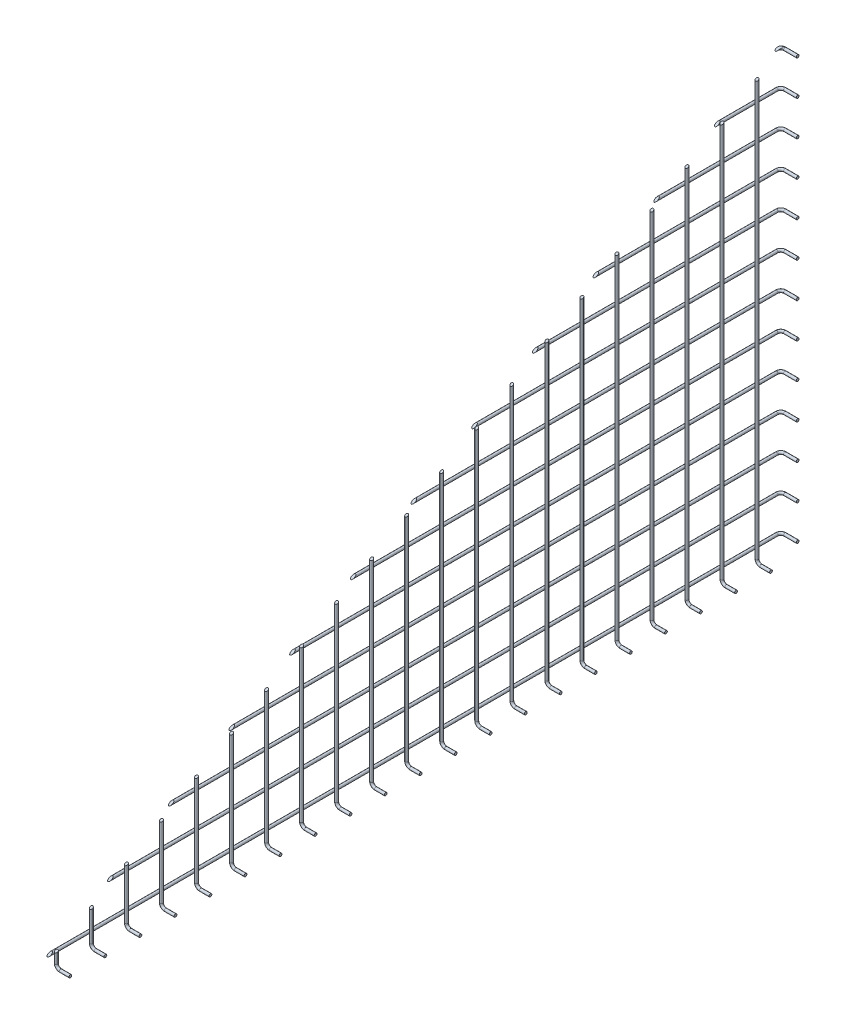
from build123d import *

# Parameters (mm, degrees)
SKETCH_2_R               = 2
PATTERN_LINEAR_2_COUNT   = 11
PATTERN_LINEAR_2_PITCH   = 50
PATTERN_LINEAR_3_COUNT   = 11
PATTERN_LINEAR_3_PITCH   = 50
SKETCH_4_R               = 2
PATTERN_LINEAR_4_COUNT   = 18
PATTERN_LINEAR_4_PITCH   = 50
CUT_EXTRUDE_1_DEPTH      = 1042.201229402
CUT_EXTRUDE_1_DEPTH_BACK = 1042.201229402
SKETCH_5_OUTSIDE_W       = 1361.942
SKETCH_5_OUTSIDE_H       = 1171.942


with BuildPart() as part:
    # По траектории1: sweep along a path in Эскиз1
    with BuildLine(Plane.XY) as sweep_1_path:
        Line((20, 2), (6, 2))
        ThreePointArc((6, 2), (1.757359313, 3.757359313), (0, 8))
        Line((0, 8), (0, 890))
    # Эскиз2 → По траектории1 (sweep)
    with BuildSketch(Plane(origin=(20, 0, 0), x_dir=(0, 0, -1), z_dir=(1, 0, 0))):
        with Locations((0, 2)):
            Circle(SKETCH_2_R)
    sweep(path=sweep_1_path.line)


with BuildPart() as pattern_linear_2_1:
    # Линейный массив2: pattern copy
    add(part.part.moved(Location(Vector(0, 0, -1) * (1 * PATTERN_LINEAR_2_PITCH))))


with BuildPart() as pattern_linear_2_2:
    # Линейный массив2: pattern copy
    add(part.part.moved(Location(Vector(0, 0, -1) * (2 * PATTERN_LINEAR_2_PITCH))))


with BuildPart() as pattern_linear_2_3:
    # Линейный массив2: pattern copy
    add(part.part.moved(Location(Vector(0, 0, -1) * (3 * PATTERN_LINEAR_2_PITCH))))


with BuildPart() as pattern_linear_2_4:
    # Линейный массив2: pattern copy
    add(part.part.moved(Location(Vector(0, 0, -1) * (4 * PATTERN_LINEAR_2_PITCH))))


with BuildPart() as pattern_linear_2_5:
    # Линейный массив2: pattern copy
    add(part.part.moved(Location(Vector(0, 0, -1) * (5 * PATTERN_LINEAR_2_PITCH))))


with BuildPart() as pattern_linear_2_6:
    # Линейный массив2: pattern copy
    add(part.part.moved(Location(Vector(0, 0, -1) * (6 * PATTERN_LINEAR_2_PITCH))))


with BuildPart() as pattern_linear_2_7:
    # Линейный массив2: pattern copy
    add(part.part.moved(Location(Vector(0, 0, -1) * (7 * PATTERN_LINEAR_2_PITCH))))


with BuildPart() as pattern_linear_2_8:
    # Линейный массив2: pattern copy
    add(part.part.moved(Location(Vector(0, 0, -1) * (8 * PATTERN_LINEAR_2_PITCH))))


with BuildPart() as pattern_linear_2_9:
    # Линейный массив2: pattern copy
    add(part.part.moved(Location(Vector(0, 0, -1) * (9 * PATTERN_LINEAR_2_PITCH))))


with BuildPart() as pattern_linear_2_10:
    # Линейный массив2: pattern copy
    add(part.part.moved(Location(Vector(0, 0, -1) * (10 * PATTERN_LINEAR_2_PITCH))))


with BuildPart() as pattern_linear_3_1:
    # Линейный массив3: pattern copy
    add(part.part.moved(Location(Vector(0, 0, 1) * (1 * PATTERN_LINEAR_3_PITCH))))


with BuildPart() as pattern_linear_3_2:
    # Линейный массив3: pattern copy
    add(part.part.moved(Location(Vector(0, 0, 1) * (2 * PATTERN_LINEAR_3_PITCH))))


with BuildPart() as pattern_linear_3_3:
    # Линейный массив3: pattern copy
    add(part.part.moved(Location(Vector(0, 0, 1) * (3 * PATTERN_LINEAR_3_PITCH))))


with BuildPart() as pattern_linear_3_4:
    # Линейный массив3: pattern copy
    add(part.part.moved(Location(Vector(0, 0, 1) * (4 * PATTERN_LINEAR_3_PITCH))))


with BuildPart() as pattern_linear_3_5:
    # Линейный массив3: pattern copy
    add(part.part.moved(Location(Vector(0, 0, 1) * (5 * PATTERN_LINEAR_3_PITCH))))


with BuildPart() as pattern_linear_3_6:
    # Линейный массив3: pattern copy
    add(part.part.moved(Location(Vector(0, 0, 1) * (6 * PATTERN_LINEAR_3_PITCH))))


with BuildPart() as pattern_linear_3_7:
    # Линейный массив3: pattern copy
    add(part.part.moved(Location(Vector(0, 0, 1) * (7 * PATTERN_LINEAR_3_PITCH))))


with BuildPart() as pattern_linear_3_8:
    # Линейный массив3: pattern copy
    add(part.part.moved(Location(Vector(0, 0, 1) * (8 * PATTERN_LINEAR_3_PITCH))))


with BuildPart() as pattern_linear_3_9:
    # Линейный массив3: pattern copy
    add(part.part.moved(Location(Vector(0, 0, 1) * (9 * PATTERN_LINEAR_3_PITCH))))


with BuildPart() as pattern_linear_3_10:
    # Линейный массив3: pattern copy
    add(part.part.moved(Location(Vector(0, 0, 1) * (10 * PATTERN_LINEAR_3_PITCH))))


with BuildPart() as body_22:
    # По траектории2: sweep along a path in Эскиз3
    with BuildLine(Plane(origin=(0, 20, 0), x_dir=(1, 0, 0), z_dir=(0, 1, 0))) as sweep_2_path:
        Line((20, 538), (2, 538))
        ThreePointArc((2, 538), (-2.242640687, 536.242640687), (-4, 532))
        Line((-4, 532), (-4, -532))
        ThreePointArc((-4, -532), (-2.242640687, -536.242640687), (2, -538))
        Line((2, -538), (20, -538))
    # Эскиз4 → По траектории2 (sweep)
    with BuildSketch(Plane(origin=(20, 0, 0), x_dir=(0, 0, -1), z_dir=(1, 0, 0))):
        with Locations((538, 20)):
            Circle(SKETCH_4_R)
    sweep_2 = sweep(path=sweep_2_path.line)


with BuildPart() as pattern_linear_4_1:
    # Линейный массив4: pattern copy
    add(sweep_2.moved(Location(Vector(0, 1, 0) * (1 * PATTERN_LINEAR_4_PITCH))))


with BuildPart() as pattern_linear_4_2:
    # Линейный массив4: pattern copy
    add(sweep_2.moved(Location(Vector(0, 1, 0) * (2 * PATTERN_LINEAR_4_PITCH))))


with BuildPart() as pattern_linear_4_3:
    # Линейный массив4: pattern copy
    add(sweep_2.moved(Location(Vector(0, 1, 0) * (3 * PATTERN_LINEAR_4_PITCH))))


with BuildPart() as pattern_linear_4_4:
    # Линейный массив4: pattern copy
    add(sweep_2.moved(Location(Vector(0, 1, 0) * (4 * PATTERN_LINEAR_4_PITCH))))


with BuildPart() as pattern_linear_4_5:
    # Линейный массив4: pattern copy
    add(sweep_2.moved(Location(Vector(0, 1, 0) * (5 * PATTERN_LINEAR_4_PITCH))))


with BuildPart() as pattern_linear_4_6:
    # Линейный массив4: pattern copy
    add(sweep_2.moved(Location(Vector(0, 1, 0) * (6 * PATTERN_LINEAR_4_PITCH))))


with BuildPart() as pattern_linear_4_7:
    # Линейный массив4: pattern copy
    add(sweep_2.moved(Location(Vector(0, 1, 0) * (7 * PATTERN_LINEAR_4_PITCH))))


with BuildPart() as pattern_linear_4_8:
    # Линейный массив4: pattern copy
    add(sweep_2.moved(Location(Vector(0, 1, 0) * (8 * PATTERN_LINEAR_4_PITCH))))


with BuildPart() as pattern_linear_4_9:
    # Линейный массив4: pattern copy
    add(sweep_2.moved(Location(Vector(0, 1, 0) * (9 * PATTERN_LINEAR_4_PITCH))))


with BuildPart() as pattern_linear_4_10:
    # Линейный массив4: pattern copy
    add(sweep_2.moved(Location(Vector(0, 1, 0) * (10 * PATTERN_LINEAR_4_PITCH))))


with BuildPart() as pattern_linear_4_11:
    # Линейный массив4: pattern copy
    add(sweep_2.moved(Location(Vector(0, 1, 0) * (11 * PATTERN_LINEAR_4_PITCH))))


with BuildPart() as pattern_linear_4_12:
    # Линейный массив4: pattern copy
    add(sweep_2.moved(Location(Vector(0, 1, 0) * (12 * PATTERN_LINEAR_4_PITCH))))


with BuildPart() as pattern_linear_4_13:
    # Линейный массив4: pattern copy
    add(sweep_2.moved(Location(Vector(0, 1, 0) * (13 * PATTERN_LINEAR_4_PITCH))))


with BuildPart() as pattern_linear_4_14:
    # Линейный массив4: pattern copy
    add(sweep_2.moved(Location(Vector(0, 1, 0) * (14 * PATTERN_LINEAR_4_PITCH))))


with BuildPart() as pattern_linear_4_15:
    # Линейный массив4: pattern copy
    add(sweep_2.moved(Location(Vector(0, 1, 0) * (15 * PATTERN_LINEAR_4_PITCH))))


with BuildPart() as pattern_linear_4_16:
    # Линейный массив4: pattern copy
    add(sweep_2.moved(Location(Vector(0, 1, 0) * (16 * PATTERN_LINEAR_4_PITCH))))


with BuildPart() as pattern_linear_4_17:
    # Линейный массив4: pattern copy
    add(sweep_2.moved(Location(Vector(0, 1, 0) * (17 * PATTERN_LINEAR_4_PITCH))))


with BuildPart() as cut_extrude_1_tool:
    # Эскиз5 outside → Вырез-Вытянуть1 (new, two sides: drawn at the far end of the back side and taken through both)
    with BuildSketch(Plane(origin=(0, 0, 0), x_dir=(0, 0, -1), z_dir=(1, 0, 0)).offset(-CUT_EXTRUDE_1_DEPTH_BACK)):
        with Locations((0, 445)):
            Rectangle(SKETCH_5_OUTSIDE_W, SKETCH_5_OUTSIDE_H)
        Polygon((-540, 0), (540, 0), (540, 623.538290725), align=None, mode=Mode.SUBTRACT)
    extrude(amount=CUT_EXTRUDE_1_DEPTH + CUT_EXTRUDE_1_DEPTH_BACK)


with BuildPart() as part_1:
    add(part.part)

    # Вырез-Вытянуть1: cut by cut_extrude_1_tool
    add(cut_extrude_1_tool.part, mode=Mode.SUBTRACT)


with BuildPart() as pattern_linear_2_1_1:
    add(pattern_linear_2_1.part)

    # Вырез-Вытянуть1: cut by cut_extrude_1_tool
    add(cut_extrude_1_tool.part, mode=Mode.SUBTRACT)


with BuildPart() as pattern_linear_2_2_1:
    add(pattern_linear_2_2.part)

    # Вырез-Вытянуть1: cut by cut_extrude_1_tool
    add(cut_extrude_1_tool.part, mode=Mode.SUBTRACT)


with BuildPart() as pattern_linear_2_3_1:
    add(pattern_linear_2_3.part)

    # Вырез-Вытянуть1: cut by cut_extrude_1_tool
    add(cut_extrude_1_tool.part, mode=Mode.SUBTRACT)


with BuildPart() as pattern_linear_2_4_1:
    add(pattern_linear_2_4.part)

    # Вырез-Вытянуть1: cut by cut_extrude_1_tool
    add(cut_extrude_1_tool.part, mode=Mode.SUBTRACT)


with BuildPart() as pattern_linear_2_5_1:
    add(pattern_linear_2_5.part)

    # Вырез-Вытянуть1: cut by cut_extrude_1_tool
    add(cut_extrude_1_tool.part, mode=Mode.SUBTRACT)


with BuildPart() as pattern_linear_2_6_1:
    add(pattern_linear_2_6.part)

    # Вырез-Вытянуть1: cut by cut_extrude_1_tool
    add(cut_extrude_1_tool.part, mode=Mode.SUBTRACT)


with BuildPart() as pattern_linear_2_7_1:
    add(pattern_linear_2_7.part)

    # Вырез-Вытянуть1: cut by cut_extrude_1_tool
    add(cut_extrude_1_tool.part, mode=Mode.SUBTRACT)


with BuildPart() as pattern_linear_2_8_1:
    add(pattern_linear_2_8.part)

    # Вырез-Вытянуть1: cut by cut_extrude_1_tool
    add(cut_extrude_1_tool.part, mode=Mode.SUBTRACT)


with BuildPart() as pattern_linear_2_9_1:
    add(pattern_linear_2_9.part)

    # Вырез-Вытянуть1: cut by cut_extrude_1_tool
    add(cut_extrude_1_tool.part, mode=Mode.SUBTRACT)


with BuildPart() as pattern_linear_2_10_1:
    add(pattern_linear_2_10.part)

    # Вырез-Вытянуть1: cut by cut_extrude_1_tool
    add(cut_extrude_1_tool.part, mode=Mode.SUBTRACT)


with BuildPart() as pattern_linear_3_1_1:
    add(pattern_linear_3_1.part)

    # Вырез-Вытянуть1: cut by cut_extrude_1_tool
    add(cut_extrude_1_tool.part, mode=Mode.SUBTRACT)


with BuildPart() as pattern_linear_3_2_1:
    add(pattern_linear_3_2.part)

    # Вырез-Вытянуть1: cut by cut_extrude_1_tool
    add(cut_extrude_1_tool.part, mode=Mode.SUBTRACT)


with BuildPart() as pattern_linear_3_3_1:
    add(pattern_linear_3_3.part)

    # Вырез-Вытянуть1: cut by cut_extrude_1_tool
    add(cut_extrude_1_tool.part, mode=Mode.SUBTRACT)


with BuildPart() as pattern_linear_3_4_1:
    add(pattern_linear_3_4.part)

    # Вырез-Вытянуть1: cut by cut_extrude_1_tool
    add(cut_extrude_1_tool.part, mode=Mode.SUBTRACT)


with BuildPart() as pattern_linear_3_5_1:
    add(pattern_linear_3_5.part)

    # Вырез-Вытянуть1: cut by cut_extrude_1_tool
    add(cut_extrude_1_tool.part, mode=Mode.SUBTRACT)


with BuildPart() as pattern_linear_3_6_1:
    add(pattern_linear_3_6.part)

    # Вырез-Вытянуть1: cut by cut_extrude_1_tool
    add(cut_extrude_1_tool.part, mode=Mode.SUBTRACT)


with BuildPart() as pattern_linear_3_7_1:
    add(pattern_linear_3_7.part)

    # Вырез-Вытянуть1: cut by cut_extrude_1_tool
    add(cut_extrude_1_tool.part, mode=Mode.SUBTRACT)


with BuildPart() as pattern_linear_3_8_1:
    add(pattern_linear_3_8.part)

    # Вырез-Вытянуть1: cut by cut_extrude_1_tool
    add(cut_extrude_1_tool.part, mode=Mode.SUBTRACT)


with BuildPart() as pattern_linear_3_9_1:
    add(pattern_linear_3_9.part)

    # Вырез-Вытянуть1: cut by cut_extrude_1_tool
    add(cut_extrude_1_tool.part, mode=Mode.SUBTRACT)


with BuildPart() as pattern_linear_3_10_1:
    add(pattern_linear_3_10.part)

    # Вырез-Вытянуть1: cut by cut_extrude_1_tool
    add(cut_extrude_1_tool.part, mode=Mode.SUBTRACT)


with BuildPart() as body_22_1:
    add(body_22.part)

    # Вырез-Вытянуть1: cut by cut_extrude_1_tool
    add(cut_extrude_1_tool.part, mode=Mode.SUBTRACT)


with BuildPart() as pattern_linear_4_1_1:
    add(pattern_linear_4_1.part)

    # Вырез-Вытянуть1: cut by cut_extrude_1_tool
    add(cut_extrude_1_tool.part, mode=Mode.SUBTRACT)


with BuildPart() as pattern_linear_4_2_1:
    add(pattern_linear_4_2.part)

    # Вырез-Вытянуть1: cut by cut_extrude_1_tool
    add(cut_extrude_1_tool.part, mode=Mode.SUBTRACT)


with BuildPart() as pattern_linear_4_3_1:
    add(pattern_linear_4_3.part)

    # Вырез-Вытянуть1: cut by cut_extrude_1_tool
    add(cut_extrude_1_tool.part, mode=Mode.SUBTRACT)


with BuildPart() as pattern_linear_4_4_1:
    add(pattern_linear_4_4.part)

    # Вырез-Вытянуть1: cut by cut_extrude_1_tool
    add(cut_extrude_1_tool.part, mode=Mode.SUBTRACT)


with BuildPart() as pattern_linear_4_5_1:
    add(pattern_linear_4_5.part)

    # Вырез-Вытянуть1: cut by cut_extrude_1_tool
    add(cut_extrude_1_tool.part, mode=Mode.SUBTRACT)


with BuildPart() as pattern_linear_4_6_1:
    add(pattern_linear_4_6.part)

    # Вырез-Вытянуть1: cut by cut_extrude_1_tool
    add(cut_extrude_1_tool.part, mode=Mode.SUBTRACT)


with BuildPart() as pattern_linear_4_7_1:
    add(pattern_linear_4_7.part)

    # Вырез-Вытянуть1: cut by cut_extrude_1_tool
    add(cut_extrude_1_tool.part, mode=Mode.SUBTRACT)


with BuildPart() as pattern_linear_4_8_1:
    add(pattern_linear_4_8.part)

    # Вырез-Вытянуть1: cut by cut_extrude_1_tool
    add(cut_extrude_1_tool.part, mode=Mode.SUBTRACT)


with BuildPart() as pattern_linear_4_9_1:
    add(pattern_linear_4_9.part)

    # Вырез-Вытянуть1: cut by cut_extrude_1_tool
    add(cut_extrude_1_tool.part, mode=Mode.SUBTRACT)


with BuildPart() as pattern_linear_4_10_1:
    add(pattern_linear_4_10.part)

    # Вырез-Вытянуть1: cut by cut_extrude_1_tool
    add(cut_extrude_1_tool.part, mode=Mode.SUBTRACT)


with BuildPart() as pattern_linear_4_11_1:
    add(pattern_linear_4_11.part)

    # Вырез-Вытянуть1: cut by cut_extrude_1_tool
    add(cut_extrude_1_tool.part, mode=Mode.SUBTRACT)


with BuildPart() as pattern_linear_4_12_1:
    add(pattern_linear_4_12.part)

    # Вырез-Вытянуть1: cut by cut_extrude_1_tool
    add(cut_extrude_1_tool.part, mode=Mode.SUBTRACT)


with BuildPart() as pattern_linear_4_13_1:
    add(pattern_linear_4_13.part)

    # Вырез-Вытянуть1: cut by cut_extrude_1_tool
    add(cut_extrude_1_tool.part, mode=Mode.SUBTRACT)


with BuildPart() as pattern_linear_4_14_1:
    add(pattern_linear_4_14.part)

    # Вырез-Вытянуть1: cut by cut_extrude_1_tool
    add(cut_extrude_1_tool.part, mode=Mode.SUBTRACT)


with BuildPart() as pattern_linear_4_15_1:
    add(pattern_linear_4_15.part)

    # Вырез-Вытянуть1: cut by cut_extrude_1_tool
    add(cut_extrude_1_tool.part, mode=Mode.SUBTRACT)


with BuildPart() as pattern_linear_4_16_1:
    add(pattern_linear_4_16.part)

    # Вырез-Вытянуть1: cut by cut_extrude_1_tool
    add(cut_extrude_1_tool.part, mode=Mode.SUBTRACT)


with BuildPart() as pattern_linear_4_17_1:
    add(pattern_linear_4_17.part)

    # Вырез-Вытянуть1: cut by cut_extrude_1_tool
    add(cut_extrude_1_tool.part, mode=Mode.SUBTRACT)


solid = Compound([part_1.part, pattern_linear_2_1_1.part, pattern_linear_2_2_1.part, pattern_linear_2_3_1.part, pattern_linear_2_4_1.part, pattern_linear_2_5_1.part, pattern_linear_2_6_1.part, pattern_linear_2_7_1.part, pattern_linear_2_8_1.part, pattern_linear_2_9_1.part, pattern_linear_2_10_1.part, pattern_linear_3_1_1.part, pattern_linear_3_2_1.part, pattern_linear_3_3_1.part, pattern_linear_3_4_1.part, pattern_linear_3_5_1.part, pattern_linear_3_6_1.part, pattern_linear_3_7_1.part, pattern_linear_3_8_1.part, pattern_linear_3_9_1.part, pattern_linear_3_10_1.part, body_22_1.part, pattern_linear_4_1_1.part, pattern_linear_4_2_1.part, pattern_linear_4_3_1.part, pattern_linear_4_4_1.part, pattern_linear_4_5_1.part, pattern_linear_4_6_1.part, pattern_linear_4_7_1.part, pattern_linear_4_8_1.part, pattern_linear_4_9_1.part, pattern_linear_4_10_1.part, pattern_linear_4_11_1.part, pattern_linear_4_12_1.part])
